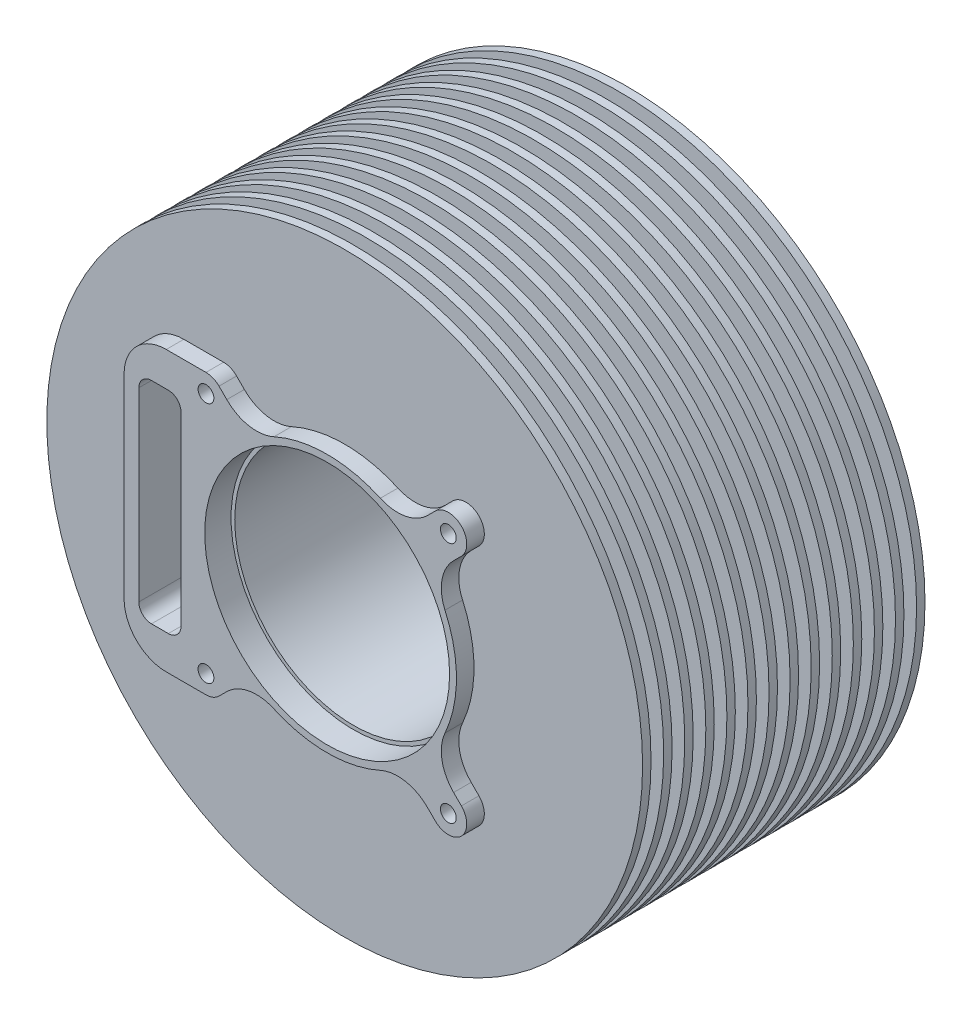
from build123d import *

# Parameters (mm, degrees)
SKETCH1_R           = 3.75
SKETCH1_R_2         = 56.35
BOSS_EXTRUDE1_DEPTH = 142.33
SKETCH2_R           = 58.1
CUT_EXTRUDE1_DEPTH  = 12.5
BOSS_EXTRUDE2_DEPTH = 142.33
SKETCH5_R           = 141.35
BOSS_EXTRUDE3_DEPTH = 4
LPATTERN1_COUNT     = 14
LPATTERN1_PITCH     = 10


with BuildPart() as part:
    # Sketch1 → Boss-Extrude1 (new body)
    with BuildSketch(Plane.XY):
        with BuildLine():
            Line((-91.753874008, 59.998242678), (-95.442815665, 63.687184335))
            ThreePointArc((-95.442815665, 63.687184335), (-107.817184335, 63.687184335), (-107.817184335, 51.312815665))
            Line((-107.817184335, 51.312815665), (-104.128242678, 47.623874008))
            ThreePointArc((-104.128242678, 47.623874008), (-98.595683476, 37.074283929), (-100.042872881, 25.250210816))
            ThreePointArc((-100.042872881, 25.250210816), (-105.48, 0), (-100.042872881, -25.250210816))
            ThreePointArc((-100.042872881, -25.250210816), (-98.595683476, -37.074283929), (-104.128242678, -47.623874008))
            Line((-104.128242678, -47.623874008), (-107.817184335, -51.312815665))
            ThreePointArc((-107.817184335, -51.312815665), (-107.817184335, -63.687184335), (-95.442815665, -63.687184335))
            Line((-95.442815665, -63.687184335), (-91.753874008, -59.998242678))
            ThreePointArc((-91.753874008, -59.998242678), (-81.204283929, -54.465683476), (-69.380210816, -55.912872881))
            ThreePointArc((-69.380210816, -55.912872881), (-44.13, -61.35), (-18.879789184, -55.912872881))
            ThreePointArc((-18.879789184, -55.912872881), (-7.055716071, -54.465683476), (3.493874008, -59.998242678))
            Line((3.493874008, -59.998242678), (7.182815665, -63.687184335))
            ThreePointArc((7.182815665, -63.687184335), (19.557184335, -63.687184335), (19.557184335, -51.312815665))
            Line((19.557184335, -51.312815665), (15.868242678, -47.623874008))
            ThreePointArc((15.868242678, -47.623874008), (10.335683476, -37.074283929), (11.782872881, -25.250210816))
            ThreePointArc((11.782872881, -25.250210816), (17.22, 0), (11.782872881, 25.250210816))
            ThreePointArc((11.782872881, 25.250210816), (10.335683476, 37.074283929), (15.868242678, 47.623874008))
            Line((15.868242678, 47.623874008), (19.557184335, 51.312815665))
            ThreePointArc((19.557184335, 51.312815665), (19.557184335, 63.687184335), (7.182815665, 63.687184335))
            Line((7.182815665, 63.687184335), (3.493874008, 59.998242678))
            ThreePointArc((3.493874008, 59.998242678), (-7.055716071, 54.465683476), (-18.879789184, 55.912872881))
            ThreePointArc((-18.879789184, 55.912872881), (-44.13, 61.35), (-69.380210816, 55.912872881))
            ThreePointArc((-69.380210816, 55.912872881), (-81.204283929, 54.465683476), (-91.753874008, 59.998242678))
        make_face()
        with Locations((-101.63, -57.5)):
            Circle(SKETCH1_R, mode=Mode.SUBTRACT)
        with Locations((13.37, -57.5)):
            Circle(SKETCH1_R, mode=Mode.SUBTRACT)
        with Locations((13.37, 57.5)):
            Circle(SKETCH1_R, mode=Mode.SUBTRACT)
        with Locations((-44.13, 0)):
            Circle(SKETCH1_R_2, mode=Mode.SUBTRACT)
        with Locations((-101.63, 57.5)):
            Circle(SKETCH1_R, mode=Mode.SUBTRACT)
    extrude(amount=BOSS_EXTRUDE1_DEPTH)

    # Sketch2 → Cut-Extrude1 (cut)
    with BuildSketch(Plane.XY.offset(142.33)):
        with Locations((-44.13, 0)):
            Circle(SKETCH2_R)
    extrude(amount=-CUT_EXTRUDE1_DEPTH, mode=Mode.SUBTRACT)

    # Sketch4 → Boss-Extrude2 (add)
    with BuildSketch(Plane.XY):
        with BuildLine():
            Line((-104.128242678, -47.623874008), (-107.817184335, -51.312815665))
            ThreePointArc((-107.817184335, -51.312815665), (-109.713945909, -60.848480033), (-101.63, -66.25))
            Line((-101.63, -66.25), (-120.48, -66.25))
            ThreePointArc((-120.48, -66.25), (-134.622135624, -60.392135624), (-140.48, -46.25))
            Line((-140.48, -46.25), (-140.48, 46.25))
            ThreePointArc((-140.48, 46.25), (-134.622135624, 60.392135624), (-120.48, 66.25))
            Line((-120.48, 66.25), (-101.63, 66.25))
            ThreePointArc((-101.63, 66.25), (-109.713945909, 60.848480033), (-107.817184335, 51.312815665))
            Line((-107.817184335, 51.312815665), (-104.128242678, 47.623874008))
            ThreePointArc((-104.128242678, 47.623874008), (-98.595683476, 37.074283929), (-100.042872881, 25.250210816))
            ThreePointArc((-100.042872881, 25.250210816), (-105.48, 0), (-100.042872881, -25.250210816))
            ThreePointArc((-100.042872881, -25.250210816), (-98.595683476, -37.074283929), (-104.128242678, -47.623874008))
        make_face()
        with BuildLine():
            Line((-127.48, 50), (-119.48, 50))
            ThreePointArc((-119.48, 50), (-115.237359313, 48.242640687), (-113.48, 44))
            Line((-113.48, 44), (-113.48, -44))
            ThreePointArc((-113.48, -44), (-115.237359313, -48.242640687), (-119.48, -50))
            Line((-119.48, -50), (-127.48, -50))
            ThreePointArc((-127.48, -50), (-131.722640687, -48.242640687), (-133.48, -44))
            Line((-133.48, -44), (-133.48, 44))
            ThreePointArc((-133.48, 44), (-131.722640687, 48.242640687), (-127.48, 50))
        make_face(mode=Mode.SUBTRACT)
    extrude(amount=BOSS_EXTRUDE2_DEPTH)

    # Sketch5 → Boss-Extrude3 (add)
    with BuildSketch(Plane.XY):
        with Locations((-44.13, 0)):
            Circle(SKETCH5_R)
        with BuildLine():
            ThreePointArc((-120.48, 66.25), (-134.622135624, 60.392135624), (-140.48, 46.25))
            Line((-140.48, 46.25), (-140.48, -46.25))
            ThreePointArc((-140.48, -46.25), (-134.622135624, -60.392135624), (-120.48, -66.25))
            Line((-120.48, -66.25), (-101.63, -66.25))
            ThreePointArc((-101.63, -66.25), (-98.281519967, -65.583945909), (-95.442815665, -63.687184335))
            Line((-95.442815665, -63.687184335), (-91.753874008, -59.998242678))
            ThreePointArc((-91.753874008, -59.998242678), (-81.204283929, -54.465683476), (-69.380210816, -55.912872881))
            ThreePointArc((-69.380210816, -55.912872881), (-44.13, -61.35), (-18.879789184, -55.912872881))
            ThreePointArc((-18.879789184, -55.912872881), (-7.055716071, -54.465683476), (3.493874008, -59.998242678))
            Line((3.493874008, -59.998242678), (7.182815665, -63.687184335))
            ThreePointArc((7.182815665, -63.687184335), (19.557184335, -63.687184335), (19.557184335, -51.312815665))
            Line((19.557184335, -51.312815665), (15.868242678, -47.623874008))
            ThreePointArc((15.868242678, -47.623874008), (10.335683476, -37.074283929), (11.782872881, -25.250210816))
            ThreePointArc((11.782872881, -25.250210816), (17.22, 0), (11.782872881, 25.250210816))
            ThreePointArc((11.782872881, 25.250210816), (10.335683476, 37.074283929), (15.868242678, 47.623874008))
            Line((15.868242678, 47.623874008), (19.557184335, 51.312815665))
            ThreePointArc((19.557184335, 51.312815665), (19.557184335, 63.687184335), (7.182815665, 63.687184335))
            Line((7.182815665, 63.687184335), (3.493874008, 59.998242678))
            ThreePointArc((3.493874008, 59.998242678), (-7.055716071, 54.465683476), (-18.879789184, 55.912872881))
            ThreePointArc((-18.879789184, 55.912872881), (-44.13, 61.35), (-69.380210816, 55.912872881))
            ThreePointArc((-69.380210816, 55.912872881), (-81.204283929, 54.465683476), (-91.753874008, 59.998242678))
            Line((-91.753874008, 59.998242678), (-95.442815665, 63.687184335))
            ThreePointArc((-95.442815665, 63.687184335), (-98.281519967, 65.583945909), (-101.63, 66.25))
            Line((-101.63, 66.25), (-120.48, 66.25))
        make_face(mode=Mode.SUBTRACT)
    boss_extrude3 = extrude(amount=BOSS_EXTRUDE3_DEPTH)

    # LPattern1: Boss-Extrude3 ×14
    with Locations(*[(0, 0, i * LPATTERN1_PITCH) for i in range(1, LPATTERN1_COUNT)]):
        add(boss_extrude3)


solid = part.part
